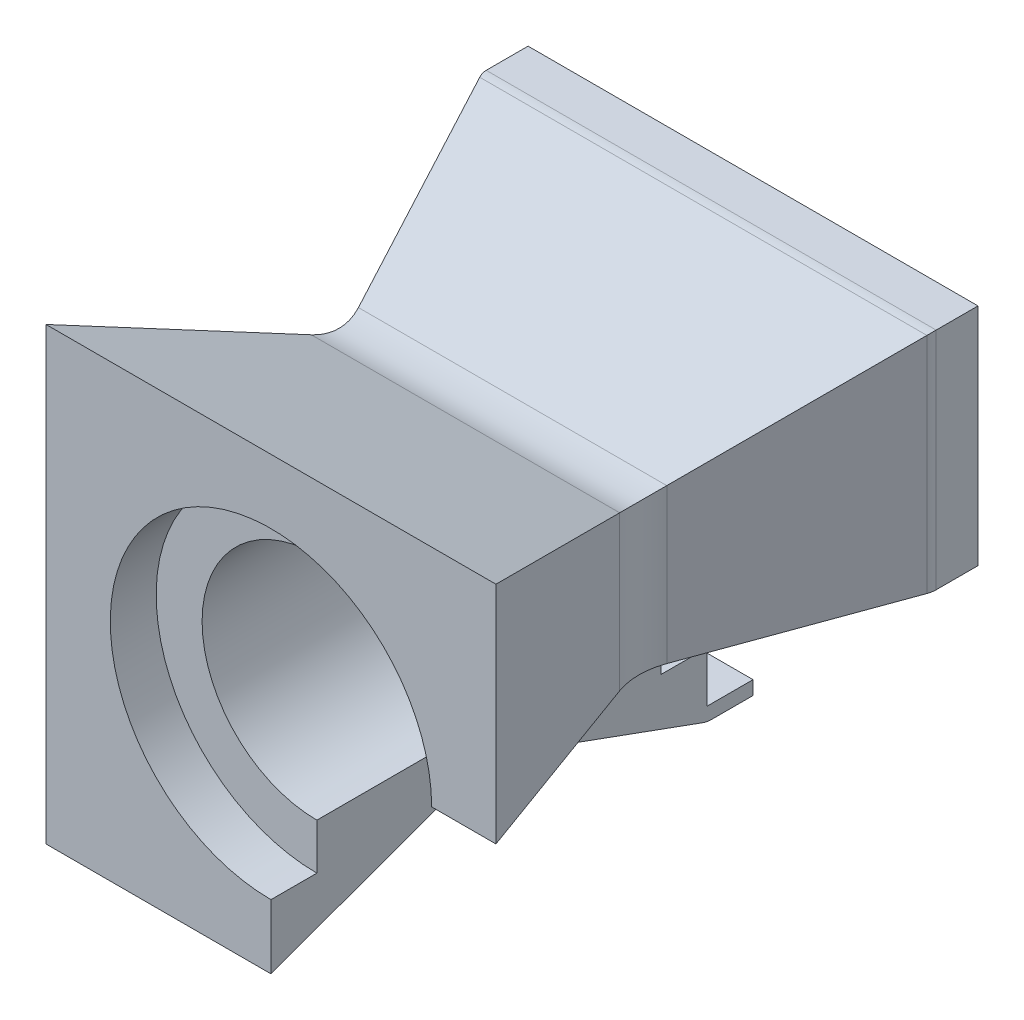
from build123d import *

# Parameters (mm, degrees)
ESQUISSE1_W             = 98
ESQUISSE1_H             = 98
BOSS_EXTRU_1_DEPTH      = 47.5
BOSS_EXTRU_1_TAPER      = 20
ESQUISSE2_R             = 25
ENL_V_MAT_EXTRU_1_DEPTH = 147.50682578
ENL_V_MAT_EXTRU_4_DEPTH = 169.026783579
CONG_1_R                = 15
ESQUISSE4_R             = 35
ENL_V_MAT_EXTRU_5_DEPTH = 10
ENL_V_START             = -10
ESQUISSE5_R             = 35
ENL_V_MAT_EXTRU_6_DEPTH = 10
BOSS_EXTRU_2_DEPTH      = 10
CONG_2_R                = 5
ENL_V_MAT_EXTRU_7_DEPTH = 10


with BuildPart() as part:
    # Esquisse1 → Boss.-Extru.1 (new body)
    with BuildSketch(Plane.XY):
        with Locations((49, 49)):
            Rectangle(ESQUISSE1_W, ESQUISSE1_H)
    boss_extru_1 = extrude(amount=BOSS_EXTRU_1_DEPTH, taper=BOSS_EXTRU_1_TAPER)

    # Esquisse2 → Enlèv. mat.-Extru.1 (cut, through all)
    with BuildSketch(Plane(origin=(0, 0, 0), x_dir=(-1, 0, 0), z_dir=(0, 0, -1))):
        with Locations((-49, 49)):
            Circle(ESQUISSE2_R)
    enl_v_mat_extru_1 = extrude(amount=-ENL_V_MAT_EXTRU_1_DEPTH, mode=Mode.SUBTRACT)

    # Symétrie1: Boss.-Extru.1, Enlèv. mat.-Extru.1 across plane
    add(boss_extru_1.mirror(Plane.XY.offset(47.5)))
    add(enl_v_mat_extru_1.mirror(Plane.XY.offset(47.5)), mode=Mode.SUBTRACT)

    # Esquisse3 → Enlèv. mat.-Extru.4 (cut, through all)
    with BuildSketch(Plane.XY.offset(95)):
        with BuildLine():
            ThreePointArc((74, 49), (66.67766953, 31.32233047), (49, 24))
            Line((49, 24), (49, 0))
            Line((49, 0), (98, 0))
            Line((98, 0), (98, 49))
            Line((98, 49), (74, 49))
        make_face()
    extrude(amount=-ENL_V_MAT_EXTRU_4_DEPTH, mode=Mode.SUBTRACT)

    # Congé1
    cong_1_edges = [part.edges().sort_by_distance(p)[0] for p in [
        (33.144293064, 17.288586128, 47.5),
        (17.288586128, 49, 47.5),
        (80.711413872, 64.855706936, 47.5),
        (49, 80.711413872, 47.5),
    ]]
    fillet(cong_1_edges, radius=CONG_1_R)

    # Esquisse4 → Enlèv. mat.-Extru.5 (cut)
    with BuildSketch(Plane.XY.offset(95)):
        with Locations((49, 49)):
            Circle(ESQUISSE4_R)
    extrude(amount=-ENL_V_MAT_EXTRU_5_DEPTH, mode=Mode.SUBTRACT)

    # Esquisse5 → Enlèv. mat.-Extru.6 (cut)
    with BuildSketch(Plane(origin=(0, 0, 0), x_dir=(-1, 0, 0), z_dir=(0, 0, -1)).offset(ENL_V_START)):
        with Locations((-49, 49)):
            Circle(ESQUISSE5_R)
    extrude(amount=ENL_V_MAT_EXTRU_6_DEPTH, mode=Mode.SUBTRACT)

    # Esquisse6 → Boss.-Extru.2 (add)
    with BuildSketch(Plane(origin=(0, 0, 0), x_dir=(-1, 0, 0), z_dir=(0, 0, -1))):
        Polygon((-98, 49), (-98, 98), (0, 98), (0, 0), (-49, 0), (-49, 3), (-3, 3), (-3, 95), (-95, 95), (-95, 49), align=None)
    extrude(amount=BOSS_EXTRU_2_DEPTH)

    # Congé2
    cong_2_edges = [part.edges().sort_by_distance(p)[0] for p in [
        (98, 73.5, 0),
        (0, 49, 0),
        (24.5, 0, 0),
        (49, 98, 0),
    ]]
    fillet(cong_2_edges, radius=CONG_2_R)

    # Esquisse7 → Enlèv. mat.-Extru.7 (cut)
    with BuildSketch(Plane(origin=(0, 0, 0), x_dir=(-1, 0, 0), z_dir=(0, 0, -1))):
        with BuildLine():
            Line((-87.537319575, 91.779960262), (-76.930717857, 81.173358544))
            ThreePointArc((-76.930717857, 81.173358544), (-76.930717857, 76.930717857), (-81.173358544, 76.930717857))
            Line((-81.173358544, 76.930717857), (-91.779960262, 87.537319575))
            ThreePointArc((-91.779960262, 87.537319575), (-91.779960262, 91.779960262), (-87.537319575, 91.779960262))
        make_face()
        with BuildLine():
            Line((-6.220039738, 87.537319575), (-16.826641456, 76.930717857))
            ThreePointArc((-16.826641456, 76.930717857), (-21.069282143, 76.930717857), (-21.069282143, 81.173358544))
            Line((-21.069282143, 81.173358544), (-10.462680425, 91.779960262))
            ThreePointArc((-10.462680425, 91.779960262), (-6.220039738, 91.779960262), (-6.220039738, 87.537319575))
        make_face()
        with BuildLine():
            Line((-10.462680425, 6.220039738), (-21.069282143, 16.826641456))
            ThreePointArc((-21.069282143, 16.826641456), (-21.069282143, 21.069282143), (-16.826641456, 21.069282143))
            Line((-16.826641456, 21.069282143), (-6.220039738, 10.462680425))
            ThreePointArc((-6.220039738, 10.462680425), (-6.220039738, 6.220039738), (-10.462680425, 6.220039738))
        make_face()
    extrude(amount=-ENL_V_MAT_EXTRU_7_DEPTH, mode=Mode.SUBTRACT)


solid = part.part
